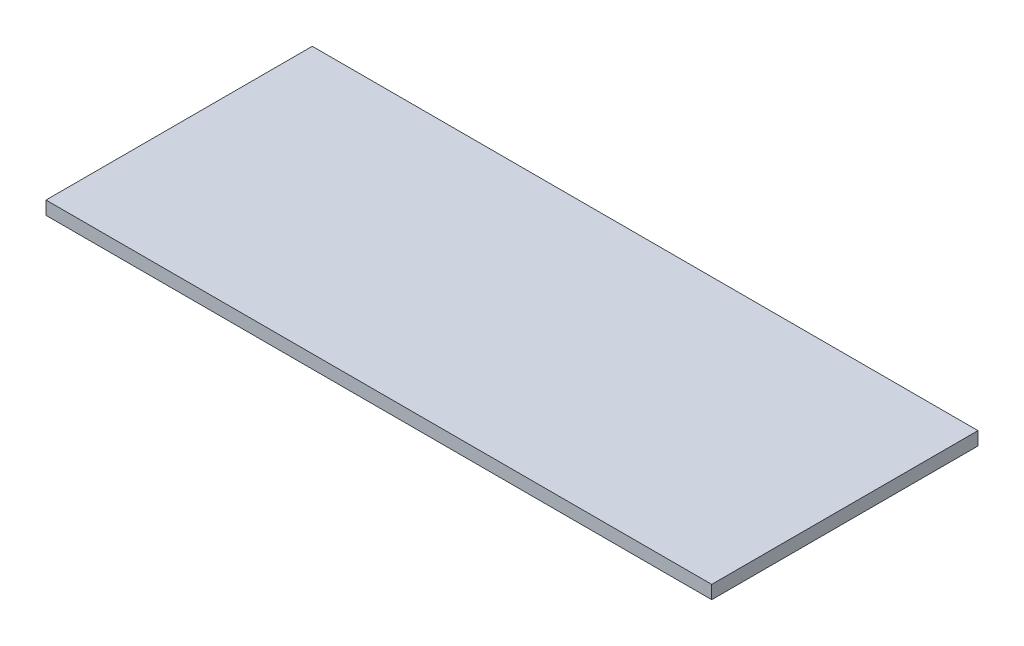
from build123d import *

# Parameters (mm, degrees)
SKETCH1_W           = 2500
SKETCH1_H           = 1000
BOSS_EXTRUDE1_DEPTH = 50


with BuildPart() as part:
    # Sketch1 → Boss-Extrude1 (new body)
    with BuildSketch(Plane(origin=(0, 0, 0), x_dir=(1, 0, 0), z_dir=(0, 1, 0))):
        Rectangle(SKETCH1_W, SKETCH1_H)
    extrude(amount=BOSS_EXTRUDE1_DEPTH)


solid = part.part
